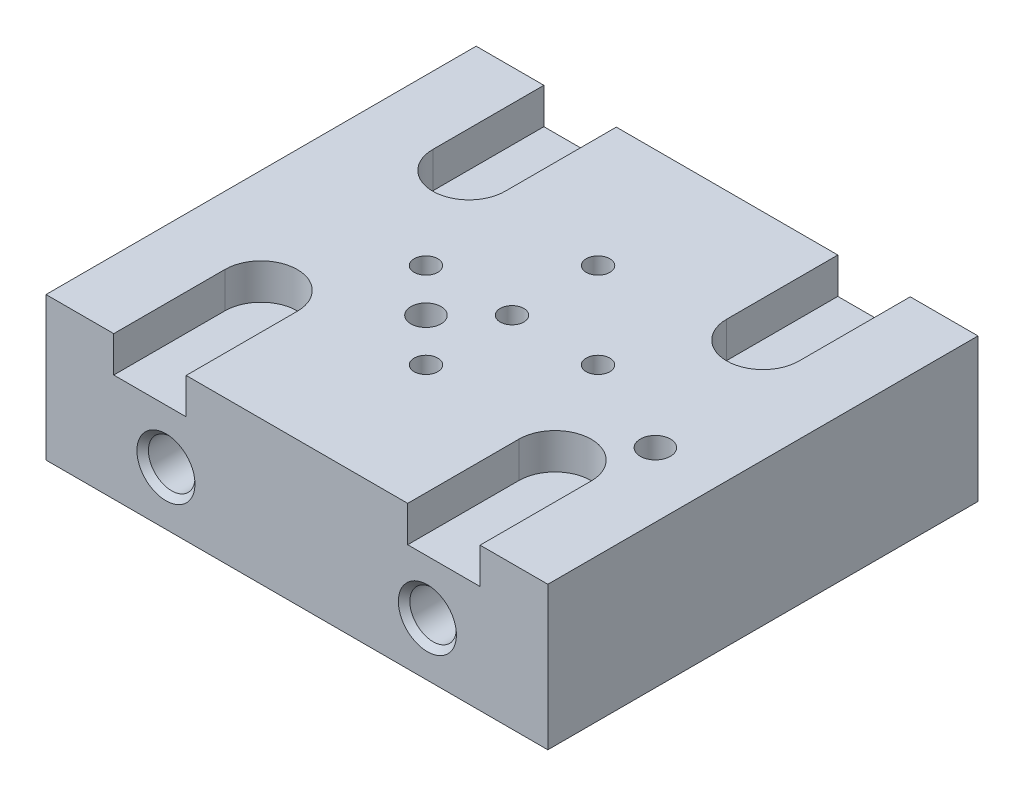
from build123d import *

# Parameters (mm, degrees)
SKETCH3_W           = 70
SKETCH3_H           = 60
BOSS_EXTRUDE3_DEPTH = 20
SKETCH4_R           = 1.65
CUT_EXTRUDE1_DEPTH  = 95.339811321
SKETCH6_R           = 2.1
CUT_EXTRUDE2_DEPTH  = 95.339811321
SKETCH9_R           = 3.25
CUT_EXTRUDE3_DEPTH  = 40.25
CUT_EXTRUDE4_START  = -3
SKETCH11_R          = 3
SKETCH11_R_2        = 1.65
CUT_EXTRUDE4_DEPTH  = 3
CUT_EXTRUDE5_DEPTH  = 5
CHAMFER1_SIZE       = 0.8


with BuildPart() as part:
    # Sketch3 → Boss-Extrude3 (new body)
    with BuildSketch(Plane(origin=(0, 0, 0), x_dir=(1, 0, 0), z_dir=(0, 1, 0))):
        with Locations((35, -30)):
            Rectangle(SKETCH3_W, SKETCH3_H)
    extrude(amount=BOSS_EXTRUDE3_DEPTH)

    # Sketch4 → Cut-Extrude1 (cut, through all)
    with BuildSketch(Plane(origin=(0, 20, 0), x_dir=(1, 0, 0), z_dir=(0, 1, 0))):
        with Locations(Location((35, -30, 0), (0, 0, 270))):
            Circle(SKETCH4_R)
        with Locations(Location((35, -18, 0), (0, 0, 270))):
            Circle(SKETCH4_R)
        with Locations(Location((47, -30, 0), (0, 0, 270))):
            Circle(SKETCH4_R)
        with Locations(Location((35, -42, 0), (0, 0, 270))):
            Circle(SKETCH4_R)
        with Locations(Location((23, -30, 0), (0, 0, 270))):
            Circle(SKETCH4_R)
    extrude(amount=-CUT_EXTRUDE1_DEPTH, mode=Mode.SUBTRACT)

    # Sketch6 → Cut-Extrude2 (cut, through all)
    with BuildSketch(Plane.XZ):
        with Locations(Location((29, 36, 0), (0, 0, 270))):
            Circle(SKETCH6_R)
        with Locations(Location((61, 36, 0), (0, 0, 270))):
            Circle(SKETCH6_R)
    extrude(amount=-CUT_EXTRUDE2_DEPTH, mode=Mode.SUBTRACT)

    # Sketch9 → Cut-Extrude3 (cut)
    with BuildSketch(Plane(origin=(0, 0, 60), x_dir=(-1, 0, 0), z_dir=(0, 0, -1))):
        with Locations((-53.2, 7.5)):
            Circle(SKETCH9_R)
        with Locations((-16.732176158, 7.5)):
            Circle(SKETCH9_R)
    extrude(amount=CUT_EXTRUDE3_DEPTH, mode=Mode.SUBTRACT)

    # Sketch11 → Cut-Extrude4 (cut)
    # profile 1 of 10: a face of its own
    with BuildSketch(Plane.XZ.offset(CUT_EXTRUDE4_START)):
        with Locations(Location((35, 18, 0), (0, 0, 270))):
            Circle(SKETCH11_R)
        with Locations(Location((35, 18, 0), (0, 0, 90))):
            Circle(SKETCH11_R_2, mode=Mode.SUBTRACT)
    # profile 2 of 10: a face of its own
    with BuildSketch(Plane.XZ.offset(CUT_EXTRUDE4_START)):
        with Locations(Location((35, 30, 0), (0, 0, 270))):
            Circle(SKETCH11_R)
        with Locations(Location((35, 30, 0), (0, 0, 90))):
            Circle(SKETCH11_R_2, mode=Mode.SUBTRACT)
    # profile 3 of 10: a face of its own
    with BuildSketch(Plane.XZ.offset(CUT_EXTRUDE4_START)):
        with Locations(Location((47, 30, 0), (0, 0, 270))):
            Circle(SKETCH11_R)
        with Locations(Location((47, 30, 0), (0, 0, 90))):
            Circle(SKETCH11_R_2, mode=Mode.SUBTRACT)
    # profile 4 of 10: a face of its own
    with BuildSketch(Plane.XZ.offset(CUT_EXTRUDE4_START)):
        with Locations(Location((23, 30, 0), (0, 0, 270))):
            Circle(SKETCH11_R)
        with Locations(Location((23, 30, 0), (0, 0, 90))):
            Circle(SKETCH11_R_2, mode=Mode.SUBTRACT)
    # profile 5 of 10: a face of its own
    with BuildSketch(Plane.XZ.offset(CUT_EXTRUDE4_START)):
        with Locations(Location((35, 42, 0), (0, 0, 270))):
            Circle(SKETCH11_R)
        with Locations(Location((35, 42, 0), (0, 0, 90))):
            Circle(SKETCH11_R_2, mode=Mode.SUBTRACT)
    # profile 6 of 10: a face of its own
    with BuildSketch(Plane.XZ.offset(CUT_EXTRUDE4_START)):
        with Locations(Location((35, 42, 0), (0, 0, 90))):
            Circle(SKETCH11_R_2)
    # profile 7 of 10: a face of its own
    with BuildSketch(Plane.XZ.offset(CUT_EXTRUDE4_START)):
        with Locations(Location((23, 30, 0), (0, 0, 90))):
            Circle(SKETCH11_R_2)
    # profile 8 of 10: a face of its own
    with BuildSketch(Plane.XZ.offset(CUT_EXTRUDE4_START)):
        with Locations(Location((35, 30, 0), (0, 0, 90))):
            Circle(SKETCH11_R_2)
    # profile 9 of 10: a face of its own
    with BuildSketch(Plane.XZ.offset(CUT_EXTRUDE4_START)):
        with Locations(Location((47, 30, 0), (0, 0, 90))):
            Circle(SKETCH11_R_2)
    # profile 10 of 10: a face of its own
    with BuildSketch(Plane.XZ.offset(CUT_EXTRUDE4_START)):
        with Locations(Location((35, 18, 0), (0, 0, 90))):
            Circle(SKETCH11_R_2)
    extrude(amount=CUT_EXTRUDE4_DEPTH, mode=Mode.SUBTRACT)

    # Sketch12 → Cut-Extrude5 (cut)
    with BuildSketch(Plane(origin=(0, 20, 0), x_dir=(1, 0, 0), z_dir=(0, 1, 0))):
        with BuildLine():
            Line((9.45, -60.104949747), (9.45, -44.5))
            ThreePointArc((9.45, -44.5), (14.5, -39.45), (19.55, -44.5))
            Line((19.55, -44.5), (19.55, -60.104949747))
            ThreePointArc((19.55, -60.104949747), (14.5, -65.154949747), (9.45, -60.104949747))
        make_face()
        with BuildLine():
            Line((60.55, -60.104949747), (60.55, -44.5))
            ThreePointArc((60.55, -44.5), (55.5, -39.45), (50.45, -44.5))
            Line((50.45, -44.5), (50.45, -60.104949747))
            ThreePointArc((50.45, -60.104949747), (55.5, -65.154949747), (60.55, -60.104949747))
        make_face()
        with BuildLine():
            Line((60.55, 0.104949747), (60.55, -15.5))
            ThreePointArc((60.55, -15.5), (55.5, -20.55), (50.45, -15.5))
            Line((50.45, -15.5), (50.45, 0.104949747))
            ThreePointArc((50.45, 0.104949747), (55.5, 5.154949747), (60.55, 0.104949747))
        make_face()
        with BuildLine():
            Line((9.45, 0.104949747), (9.45, -15.5))
            ThreePointArc((9.45, -15.5), (14.5, -20.55), (19.55, -15.5))
            Line((19.55, -15.5), (19.55, 0.104949747))
            ThreePointArc((19.55, 0.104949747), (14.5, 5.154949747), (9.45, 0.104949747))
        make_face()
    extrude(amount=-CUT_EXTRUDE5_DEPTH, mode=Mode.SUBTRACT)

    # Chamfer1
    chamfer1_edges = [part.edges().sort_by_distance(p)[0] for p in [
        (56.45, 7.5, 60),
        (19.982176158, 7.5, 60),
    ]]
    chamfer(chamfer1_edges, length=CHAMFER1_SIZE)


solid = part.part
